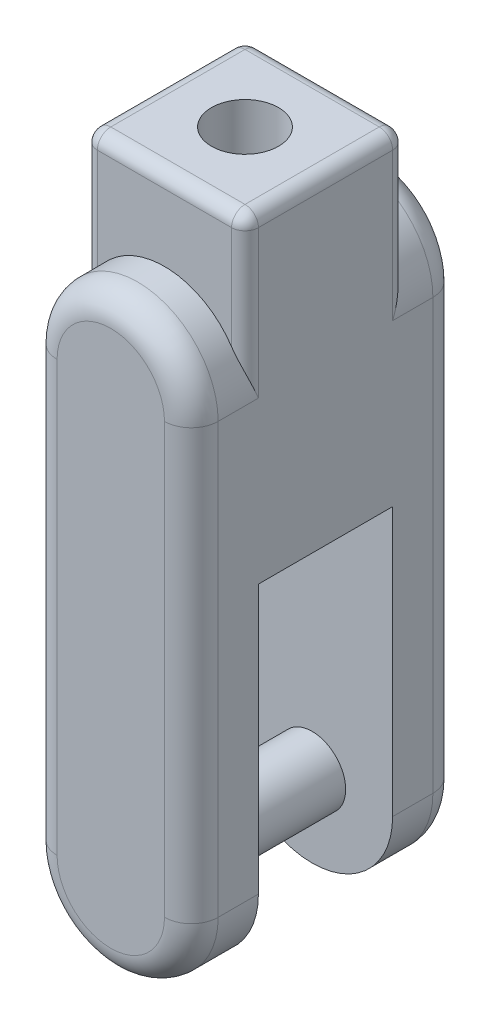
from build123d import *

# Parameters (mm, degrees)
SKETCH2_W                = 60
SKETCH2_H                = 120
BOSS_EXTRUDE1_DEPTH      = 60
SKETCH5_R                = 12.5
CUT_EXTRUDE2_DEPTH       = 48
BOSS_EXTRUDE3_DEPTH      = 20
BOSS_EXTRUDE3_DEPTH_BACK = 5
FILLET3_R                = 5
FILLET4_R                = 10
FILLET5_R                = 10
FILLET6_R                = 5
SKETCH7_R                = 12.5
BOSS_EXTRUDE4_DEPTH      = 50


with BuildPart() as part:
    # Sketch2 → Boss-Extrude1 (new body)
    with BuildSketch(Plane(origin=(0, 0, 0), x_dir=(0, 0, -1), z_dir=(1, 0, 0))):
        with Locations((0, 22.5)):
            Rectangle(SKETCH2_W, SKETCH2_H)
    extrude(amount=-BOSS_EXTRUDE1_DEPTH)

    # Sketch5 → Cut-Extrude2 (cut)
    with BuildSketch(Plane(origin=(0, 82.5, 0), x_dir=(1, 0, 0), z_dir=(0, 1, 0))):
        with Locations(Location((-30, 0, 0), (0, 0, 270))):
            Circle(SKETCH5_R)
    extrude(amount=-CUT_EXTRUDE2_DEPTH, mode=Mode.SUBTRACT)

    # Sketch6 → Boss-Extrude3 (add, two sides: drawn at the far end of the back side and taken through both)
    with BuildSketch(Plane.XY.offset(30).offset(-BOSS_EXTRUDE3_DEPTH_BACK)):
        with BuildLine():
            Line((0, 22.5), (0, -137.5))
            ThreePointArc((0, -137.5), (-30, -167.5), (-60, -137.5))
            Line((-60, -137.5), (-60, 22.5))
            ThreePointArc((-60, 22.5), (-30, 52.5), (0, 22.5))
        make_face()
    extrude(amount=BOSS_EXTRUDE3_DEPTH + BOSS_EXTRUDE3_DEPTH_BACK)

    # Fillet3
    fillet3_edges = [part.edges().sort_by_distance(p)[0] for p in [
        (-60, 52.5, 30),
        (-60, 22.5, -30),
        (0, 52.5, 30),
        (0, 82.5, 0),
        (0, 22.5, -30),
        (-60, 82.5, 0),
        (-30, 82.5, 30),
        (-30, 82.5, -30),
    ]]
    fillet(fillet3_edges, radius=FILLET3_R)


with BuildPart() as body_2:
    # Mirror2: mirrored copy
    add(part.part.mirror(Plane(origin=(0, 0, 0), x_dir=(1, 0, 0), z_dir=(0, 0, -1))))

    # Fillet5
    fillet5_edges = [body_2.edges().sort_by_distance(p)[0] for p in [
        (-30, 52.5, -50),
        (-60, -57.5, -50),
        (-30, -167.5, -50),
        (0, -57.5, -50),
    ]]
    fillet(fillet5_edges, radius=FILLET5_R)


with BuildPart() as part_1:
    add(part.part)

    # Fillet4
    fillet4_edges = [part_1.edges().sort_by_distance(p)[0] for p in [
        (-30, 52.5, 50),
        (-60, -57.5, 50),
        (-30, -167.5, 50),
        (0, -57.5, 50),
    ]]
    fillet(fillet4_edges, radius=FILLET4_R)

    # Fillet6
    fillet6_edges = [part_1.edges().sort_by_distance(p)[0] for p in [
        (0, -37.5, 0),
        (-60, -37.5, 0),
        (-30, -37.5, -30),
        (-58.535533906, -37.5, -28.535533906),
        (-1.464466094, -37.5, -28.535533906),
    ]]
    fillet(fillet6_edges, radius=FILLET6_R)

    add(body_2.part)  # Boss-Extrude4 merges body 2
    # Sketch7 → Boss-Extrude4 (add)
    with BuildSketch(Plane(origin=(0, 0, 25), x_dir=(-1, 0, 0), z_dir=(0, 0, -1))):
        with Locations(Location((30, -137.5, 0), (0, 0, 180))):
            Circle(SKETCH7_R)
    extrude(amount=BOSS_EXTRUDE4_DEPTH)


solid = part_1.part
